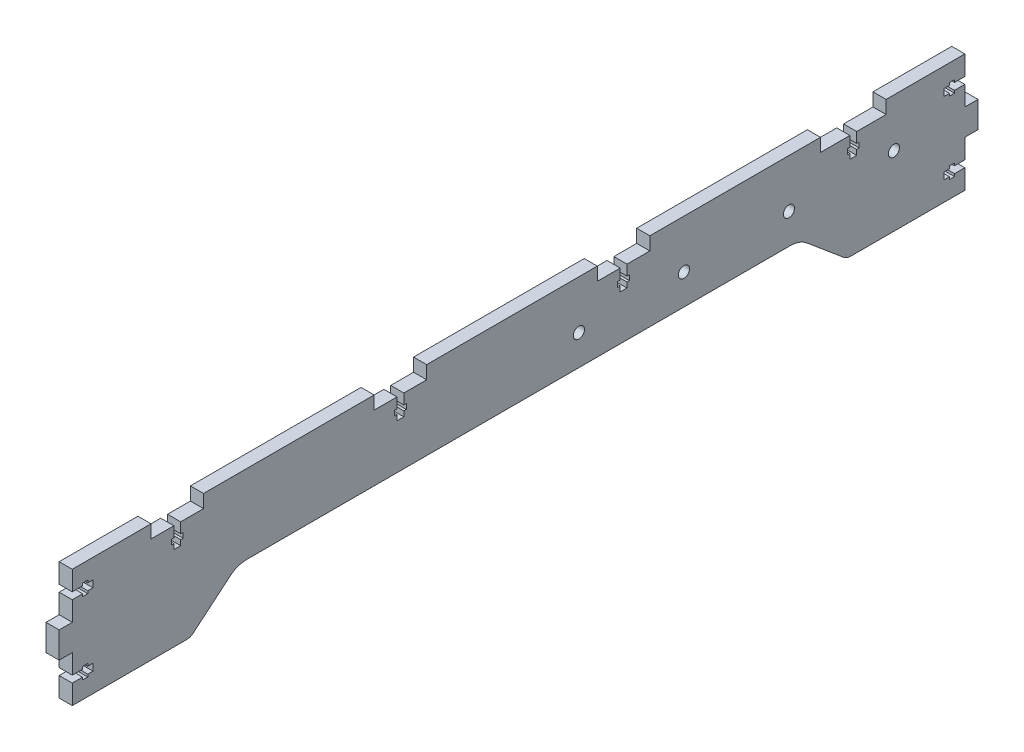
from build123d import *

# Parameters (mm, degrees)
SKETCH1_R           = 2.7
BOSS_EXTRUDE1_DEPTH = 6.35


with BuildPart() as part:
    # Sketch1 → Boss-Extrude1 (new body)
    with BuildSketch(Plane(origin=(6.35, 0, 0), x_dir=(0, 0, -1), z_dir=(1, 0, 0))):
        with BuildLine():
            Line((-44.45, 57.15), (-44.45, 50.8))
            Line((-44.45, 50.8), (-55.5, 50.8))
            Line((-55.5, 50.8), (-55.5, 45.8))
            Line((-55.5, 45.8), (-54.3, 45.8))
            Line((-54.3, 45.8), (-54.3, 43.3))
            Line((-54.3, 43.3), (-55.5, 43.3))
            Line((-55.5, 43.3), (-55.5, 40.8))
            Line((-55.5, 40.8), (-58.8, 40.8))
            Line((-58.8, 40.8), (-58.8, 43.3))
            Line((-58.8, 43.3), (-60, 43.3))
            Line((-60, 43.3), (-60, 45.8))
            Line((-60, 45.8), (-58.8, 45.8))
            Line((-58.8, 45.8), (-58.8, 50.8))
            Line((-58.8, 50.8), (-69.85, 50.8))
            Line((-69.85, 50.8), (-69.85, 57.15))
            Line((-69.85, 57.15), (-152.4, 57.15))
            Line((-152.4, 57.15), (-152.4, 50.8))
            Line((-152.4, 50.8), (-163.45, 50.8))
            Line((-163.45, 50.8), (-163.45, 45.8))
            Line((-163.45, 45.8), (-162.25, 45.8))
            Line((-162.25, 45.8), (-162.25, 43.3))
            Line((-162.25, 43.3), (-163.45, 43.3))
            Line((-163.45, 43.3), (-163.45, 40.8))
            Line((-163.45, 40.8), (-166.75, 40.8))
            Line((-166.75, 40.8), (-166.75, 43.3))
            Line((-166.75, 43.3), (-167.95, 43.3))
            Line((-167.95, 43.3), (-167.95, 45.8))
            Line((-167.95, 45.8), (-166.75, 45.8))
            Line((-166.75, 45.8), (-166.75, 50.8))
            Line((-166.75, 50.8), (-177.8, 50.8))
            Line((-177.8, 50.8), (-177.8, 57.15))
            Line((-177.8, 57.15), (-215.9, 57.15))
            Line((-215.9, 57.15), (-215.9, 47.6875))
            Line((-215.9, 47.6875), (-210.9, 47.6875))
            Line((-210.9, 47.6875), (-210.9, 48.8875))
            Line((-210.9, 48.8875), (-208.4, 48.8875))
            Line((-208.4, 48.8875), (-208.4, 47.6875))
            Line((-208.4, 47.6875), (-205.9, 47.6875))
            Line((-205.9, 47.6875), (-205.9, 44.3875))
            Line((-205.9, 44.3875), (-208.4, 44.3875))
            Line((-208.4, 44.3875), (-208.4, 43.1875))
            Line((-208.4, 43.1875), (-210.9, 43.1875))
            Line((-210.9, 43.1875), (-210.9, 44.3875))
            Line((-210.9, 44.3875), (-215.9, 44.3875))
            Line((-215.9, 44.3875), (-215.9, 34.925))
            Line((-215.9, 34.925), (-222.25, 34.925))
            Line((-222.25, 34.925), (-222.25, 22.225))
            Line((-222.25, 22.225), (-215.9, 22.225))
            Line((-215.9, 22.225), (-215.9, 12.7625))
            Line((-215.9, 12.7625), (-210.9, 12.7625))
            Line((-210.9, 12.7625), (-210.9, 13.9625))
            Line((-210.9, 13.9625), (-208.4, 13.9625))
            Line((-208.4, 13.9625), (-208.4, 12.7625))
            Line((-208.4, 12.7625), (-205.9, 12.7625))
            Line((-205.9, 12.7625), (-205.9, 9.4625))
            Line((-205.9, 9.4625), (-208.4, 9.4625))
            Line((-208.4, 9.4625), (-208.4, 8.2625))
            Line((-208.4, 8.2625), (-210.9, 8.2625))
            Line((-210.9, 8.2625), (-210.9, 9.4625))
            Line((-210.9, 9.4625), (-215.9, 9.4625))
            Line((-215.9, 9.4625), (-215.9, 0))
            Line((-215.9, 0), (-160.59896879, 0))
            ThreePointArc((-160.59896879, 0), (-158.861506462, 0.306361486), (-157.333607733, 1.188494229))
            Line((-157.333607733, 1.188494229), (-139.588074729, 16.078764428))
            ThreePointArc((-139.588074729, 16.078764428), (-135.768327906, 18.284096284), (-131.424672086, 19.05))
            Line((-131.424672086, 19.05), (131.424672086, 19.05))
            ThreePointArc((131.424672086, 19.05), (135.768327906, 18.284096284), (139.588074729, 16.078764428))
            Line((139.588074729, 16.078764428), (157.333607733, 1.188494229))
            ThreePointArc((157.333607733, 1.188494229), (158.861506462, 0.306361486), (160.59896879, 0))
            Line((160.59896879, 0), (215.9, 0))
            Line((215.9, 0), (215.9, 9.4625))
            Line((215.9, 9.4625), (210.9, 9.4625))
            Line((210.9, 9.4625), (210.9, 8.2625))
            Line((210.9, 8.2625), (208.4, 8.2625))
            Line((208.4, 8.2625), (208.4, 9.4625))
            Line((208.4, 9.4625), (205.9, 9.4625))
            Line((205.9, 9.4625), (205.9, 12.7625))
            Line((205.9, 12.7625), (208.4, 12.7625))
            Line((208.4, 12.7625), (208.4, 13.9625))
            Line((208.4, 13.9625), (210.9, 13.9625))
            Line((210.9, 13.9625), (210.9, 12.7625))
            Line((210.9, 12.7625), (215.9, 12.7625))
            Line((215.9, 12.7625), (215.9, 22.225))
            Line((215.9, 22.225), (222.25, 22.225))
            Line((222.25, 22.225), (222.25, 34.925))
            Line((222.25, 34.925), (215.9, 34.925))
            Line((215.9, 34.925), (215.9, 44.3875))
            Line((215.9, 44.3875), (210.9, 44.3875))
            Line((210.9, 44.3875), (210.9, 43.1875))
            Line((210.9, 43.1875), (208.4, 43.1875))
            Line((208.4, 43.1875), (208.4, 44.3875))
            Line((208.4, 44.3875), (205.9, 44.3875))
            Line((205.9, 44.3875), (205.9, 47.6875))
            Line((205.9, 47.6875), (208.4, 47.6875))
            Line((208.4, 47.6875), (208.4, 48.8875))
            Line((208.4, 48.8875), (210.9, 48.8875))
            Line((210.9, 48.8875), (210.9, 47.6875))
            Line((210.9, 47.6875), (215.9, 47.6875))
            Line((215.9, 47.6875), (215.9, 57.15))
            Line((215.9, 57.15), (177.8, 57.15))
            Line((177.8, 57.15), (177.8, 50.8))
            Line((177.8, 50.8), (163.575, 50.8))
            Line((163.575, 50.8), (163.575, 45.8))
            Line((163.575, 45.8), (164.775, 45.8))
            Line((164.775, 45.8), (164.775, 43.3))
            Line((164.775, 43.3), (163.575, 43.3))
            Line((163.575, 43.3), (163.575, 40.8))
            Line((163.575, 40.8), (160.275, 40.8))
            Line((160.275, 40.8), (160.275, 43.3))
            Line((160.275, 43.3), (159.075, 43.3))
            Line((159.075, 43.3), (159.075, 45.8))
            Line((159.075, 45.8), (160.275, 45.8))
            Line((160.275, 45.8), (160.275, 50.8))
            Line((160.275, 50.8), (146.05, 50.8))
            Line((146.05, 50.8), (146.05, 57.15))
            Line((146.05, 57.15), (63.5, 57.15))
            Line((63.5, 57.15), (63.5, 50.8))
            Line((63.5, 50.8), (52.45, 50.8))
            Line((52.45, 50.8), (52.45, 45.8))
            Line((52.45, 45.8), (53.65, 45.8))
            Line((53.65, 45.8), (53.65, 43.3))
            Line((53.65, 43.3), (52.45, 43.3))
            Line((52.45, 43.3), (52.45, 40.8))
            Line((52.45, 40.8), (49.15, 40.8))
            Line((49.15, 40.8), (49.15, 43.3))
            Line((49.15, 43.3), (47.95, 43.3))
            Line((47.95, 43.3), (47.95, 45.8))
            Line((47.95, 45.8), (49.15, 45.8))
            Line((49.15, 45.8), (49.15, 50.8))
            Line((49.15, 50.8), (38.1, 50.8))
            Line((38.1, 50.8), (38.1, 57.15))
            Line((38.1, 57.15), (-44.45, 57.15))
        make_face()
        with Locations(Location((79.988301448, 33.74898, 0), (0, 0, 180))):
            Circle(SKETCH1_R, mode=Mode.SUBTRACT)
        with Locations(Location((130.788301448, 33.74898, 0), (0, 0, 180))):
            Circle(SKETCH1_R, mode=Mode.SUBTRACT)
        with Locations(Location((29.188301448, 33.74898, 0), (0, 0, 180))):
            Circle(SKETCH1_R, mode=Mode.SUBTRACT)
        with Locations(Location((181.588301448, 33.74898, 0), (0, 0, 180))):
            Circle(SKETCH1_R, mode=Mode.SUBTRACT)
    extrude(amount=-BOSS_EXTRUDE1_DEPTH)


solid = part.part
